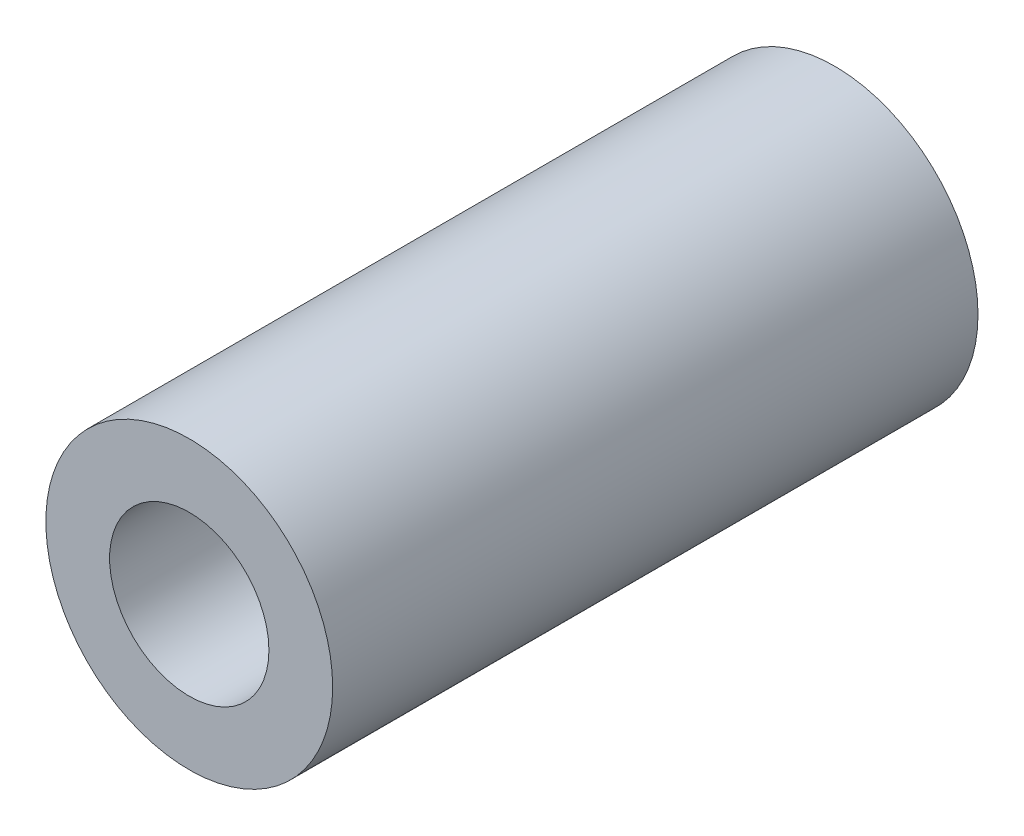
from build123d import *

# Parameters (mm, degrees)
SKETCH1_R           = 9
SKETCH1_R_2         = 5
BOSS_EXTRUDE1_DEPTH = 20.25


with BuildPart() as part:
    # Sketch1 → Boss-Extrude1 (new, symmetric)
    with BuildSketch(Plane.XY):
        Circle(SKETCH1_R)
        Circle(SKETCH1_R_2, mode=Mode.SUBTRACT)
    extrude(amount=BOSS_EXTRUDE1_DEPTH, both=True)


solid = part.part
